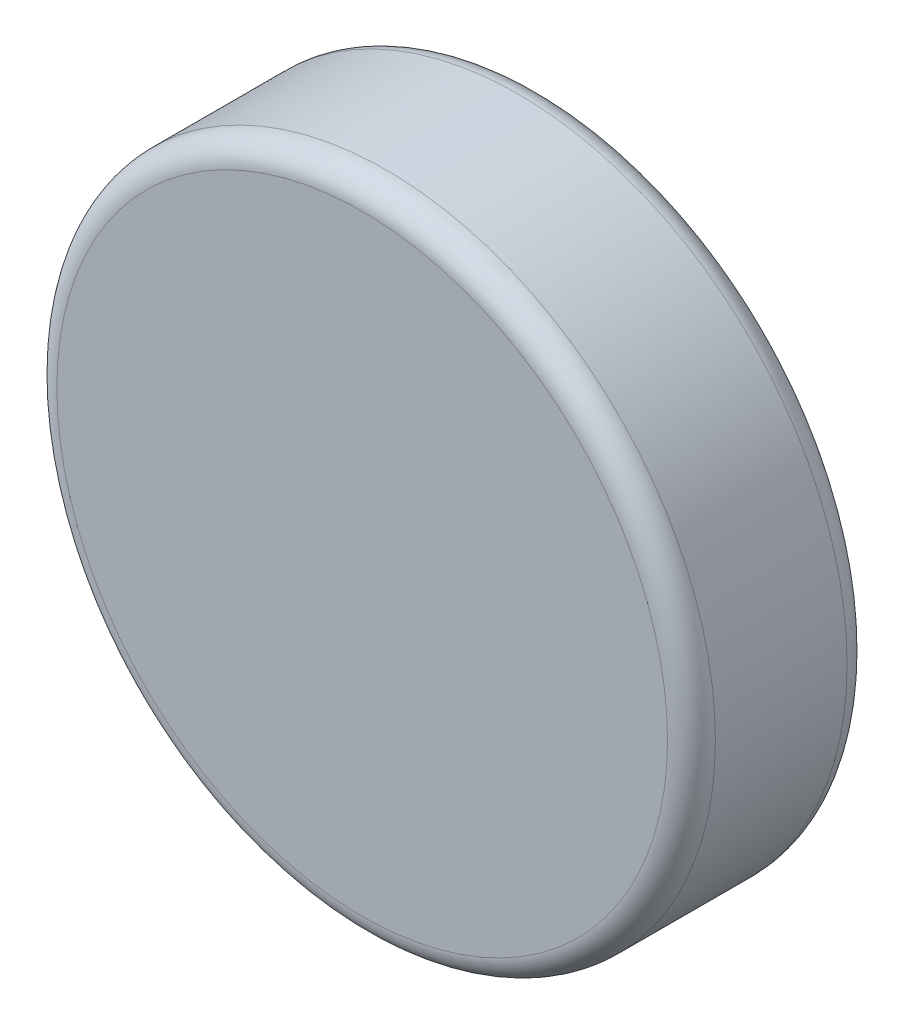
from build123d import *

# Parameters (mm, degrees)
SKICA1_R                = 27.5
P_IDAT_VYSUNUT_M1_DEPTH = 15
ZAOBLIT1_R              = 2


with BuildPart() as part:
    # Skica1 → Přidat vysunutím1 (new body)
    with BuildSketch(Plane.XY):
        Circle(SKICA1_R)
    extrude(amount=P_IDAT_VYSUNUT_M1_DEPTH)

    # Zaoblit1
    zaoblit1_edges = [part.edges().sort_by_distance(p)[0] for p in [
        (-27.5, 0, 0),
        (-27.5, 0, 15),
    ]]
    fillet(zaoblit1_edges, radius=ZAOBLIT1_R)


solid = part.part
